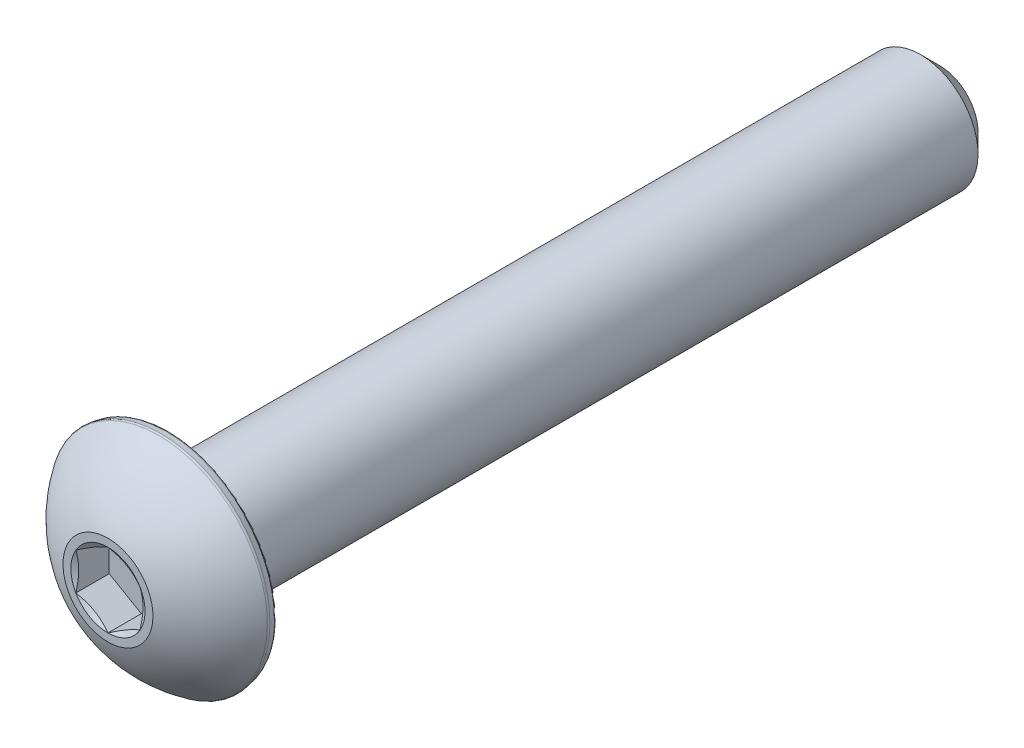
from build123d import *

# Parameters (mm, degrees)
CUT_EXTRUDE1_DEPTH = 0.82423
FILLET1_R          = 0.07493


with BuildPart() as part:
    # Sketch2 → Revolve1 (revolve)
    with BuildSketch(Plane(origin=(0, 0, 0), x_dir=(0, 0, -1), z_dir=(1, 0, 0))):
        with BuildLine():
            Line((19.05, 0), (-1.4986, 0))
            Line((-1.4986, 0), (-1.4986, 1.11125))
            ThreePointArc((-1.4986, 1.11125), (-0.991181418, 2.011660958), (-0.22479, 2.7051))
            Line((-0.22479, 2.7051), (0, 2.665463458))
            Line((0, 2.665463458), (0, 1.4224))
            Line((0, 1.4224), (18.57375, 1.4224))
            Line((18.57375, 1.4224), (19.05, 0.94615))
            Line((19.05, 0.94615), (19.05, 0))
        make_face()
    revolve(axis=Axis((0, 0, -19.05), (0, 0, 1)))

    # Sketch3 → Cut-Extrude1 (cut)
    with BuildSketch(Plane.XY.offset(1.4986)):
        Polygon((0, 0.916543552), (-0.79375, 0.458271776), (-0.79375, -0.458271776), (0, -0.916543552), (0.79375, -0.458271776), (0.79375, 0.458271776), align=None)
    extrude(amount=-CUT_EXTRUDE1_DEPTH, mode=Mode.SUBTRACT)

    # Cut-Extrude2 cone 1 section (through the dimple's axis) → Cut-Extrude2 (revolve, cut)
    with BuildSketch(Plane(origin=(0, 0, 1.4986), x_dir=(0, -1, 0), z_dir=(1, 0, 0))):
        Polygon((0, 0), (0.916543552, 0), (0, 0.529166667), align=None)
    revolve(axis=Axis((0, 0, 1.4986), (0, 0, -1)), mode=Mode.SUBTRACT)

    # Fillet1
    fillet1_edges = [part.edges().sort_by_distance(p)[0] for p in [
        (0, -2.7051, 0.22479),
        (0, -2.665463458, 0),
    ]]
    fillet(fillet1_edges, radius=FILLET1_R)


solid = part.part
